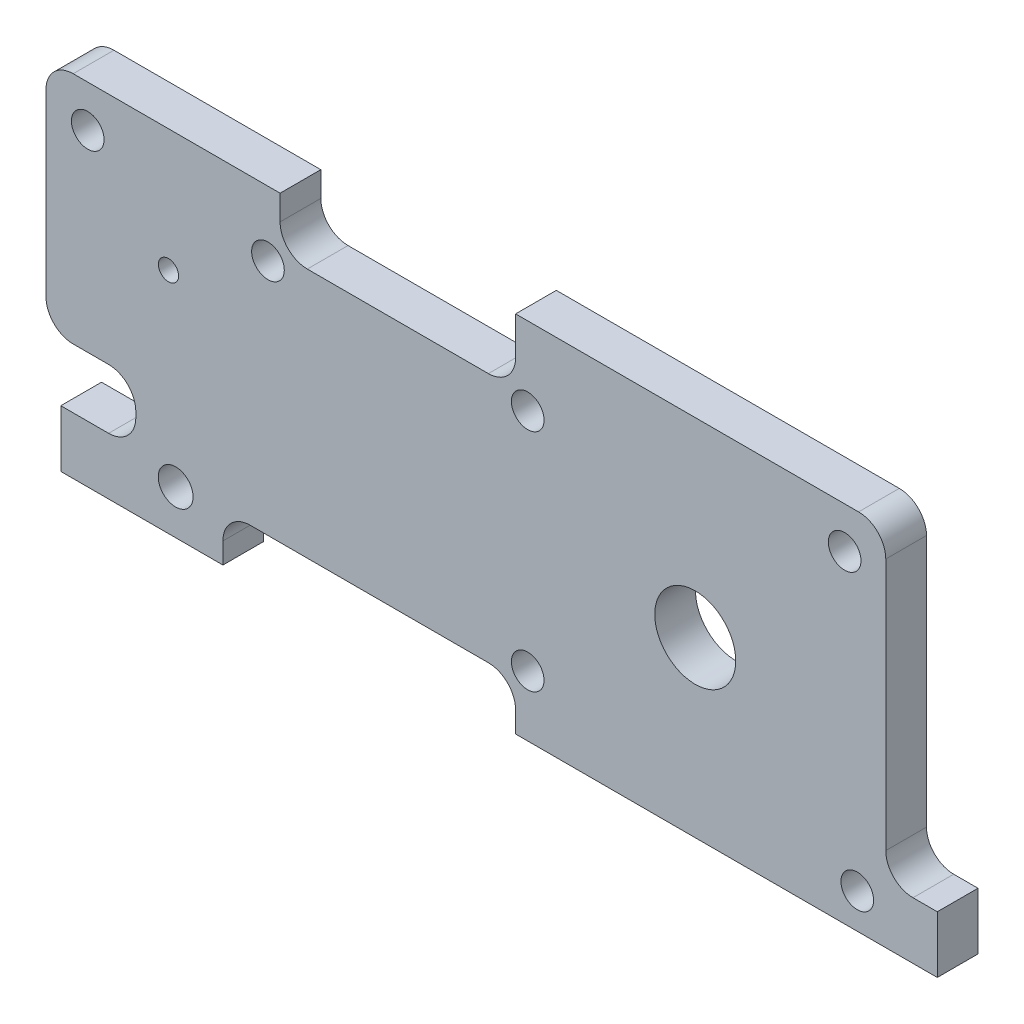
from build123d import *

# Parameters (mm, degrees)
SKETCH4_R      = 2.031992692
SKETCH4_R_2    = 1.179287719
SKETCH4_R_3    = 1.905
SKETCH4_R_4    = 4.7244
EXTRUDE3_DEPTH = 4.7498


with BuildPart() as part:
    # Sketch4 → Extrude3 (new body)
    with BuildSketch(Plane.XY):
        with BuildLine():
            Line((-42.343481517, -2.990600597), (-42.343481517, 17.964399403))
            ThreePointArc((-42.343481517, 17.964399403), (-41.413545547, 20.209463433), (-39.168481517, 21.139399403))
            Line((-39.168481517, 21.139399403), (-15.038481517, 21.139399403))
            Line((-15.038481517, 21.139399403), (-15.038481517, 18.236569756))
            ThreePointArc((-15.038481517, 18.236569756), (-14.108545547, 15.991505726), (-11.863481517, 15.061569756))
            Line((-11.863481517, 15.061569756), (9.257081626, 15.061569756))
            ThreePointArc((9.257081626, 15.061569756), (11.502145656, 15.991505726), (12.432081626, 18.236569756))
            Line((12.432081626, 18.236569756), (12.432081626, 22.681569756))
            Line((12.432081626, 22.681569756), (52.437081626, 22.681569756))
            ThreePointArc((52.437081626, 22.681569756), (54.682145656, 21.751633786), (55.612081626, 19.506569756))
            Line((55.612081626, 19.506569756), (55.612081626, -9.945714332))
            ThreePointArc((55.612081626, -9.945714332), (56.542017596, -12.190778362), (58.787081626, -13.120714332))
            Line((58.787081626, -13.120714332), (61.618454053, -13.120714332))
            Line((61.618454053, -13.120714332), (61.618454053, -19.76149571))
            Line((61.618454053, -19.76149571), (12.432081626, -19.76149571))
            Line((12.432081626, -19.76149571), (12.432081626, -17.323430244))
            ThreePointArc((12.432081626, -17.323430244), (11.502145656, -15.078366214), (9.257081626, -14.148430244))
            Line((9.257081626, -14.148430244), (-18.530518374, -14.148430244))
            ThreePointArc((-18.530518374, -14.148430244), (-20.775582404, -15.078366214), (-21.705518374, -17.323430244))
            Line((-21.705518374, -17.323430244), (-21.705518374, -19.76149571))
            Line((-21.705518374, -19.76149571), (-40.618560355, -19.76149571))
            Line((-40.618560355, -19.76149571), (-40.618560355, -13.120714332))
            Line((-40.618560355, -13.120714332), (-35.040518374, -13.120714332))
            ThreePointArc((-35.040518374, -13.120714332), (-32.795454344, -12.190778362), (-31.865518374, -9.945714332))
            Line((-31.865518374, -9.945714332), (-31.865518374, -9.340600597))
            ThreePointArc((-31.865518374, -9.340600597), (-32.795454344, -7.095536567), (-35.040518374, -6.165600597))
            Line((-35.040518374, -6.165600597), (-39.168481517, -6.165600597))
            ThreePointArc((-39.168481517, -6.165600597), (-41.413545547, -5.235664628), (-42.343481517, -2.990600597))
        make_face()
        with Locations((-27.221195322, -14.622613425)):
            Circle(SKETCH4_R, mode=Mode.SUBTRACT)
        with Locations((-28.055981517, 6.851899403)):
            Circle(SKETCH4_R_2, mode=Mode.SUBTRACT)
        with Locations((52.287415303, -15.678066597)):
            Circle(SKETCH4_R_3, mode=Mode.SUBTRACT)
        with Locations((33.387081626, 0.456569756)):
            Circle(SKETCH4_R_4, mode=Mode.SUBTRACT)
        with Locations((13.846294556, -12.683763681)):
            Circle(SKETCH4_R_3, mode=Mode.SUBTRACT)
        with Locations((13.846294556, 13.596903192)):
            Circle(SKETCH4_R_3, mode=Mode.SUBTRACT)
        with Locations((-37.474326825, 16.270244711)):
            Circle(SKETCH4_R_3, mode=Mode.SUBTRACT)
        with Locations((-16.452694446, 13.596903192)):
            Circle(SKETCH4_R_3, mode=Mode.SUBTRACT)
        with Locations((50.814973838, 17.884461968)):
            Circle(SKETCH4_R_3, mode=Mode.SUBTRACT)
    extrude(amount=EXTRUDE3_DEPTH)


solid = part.part
